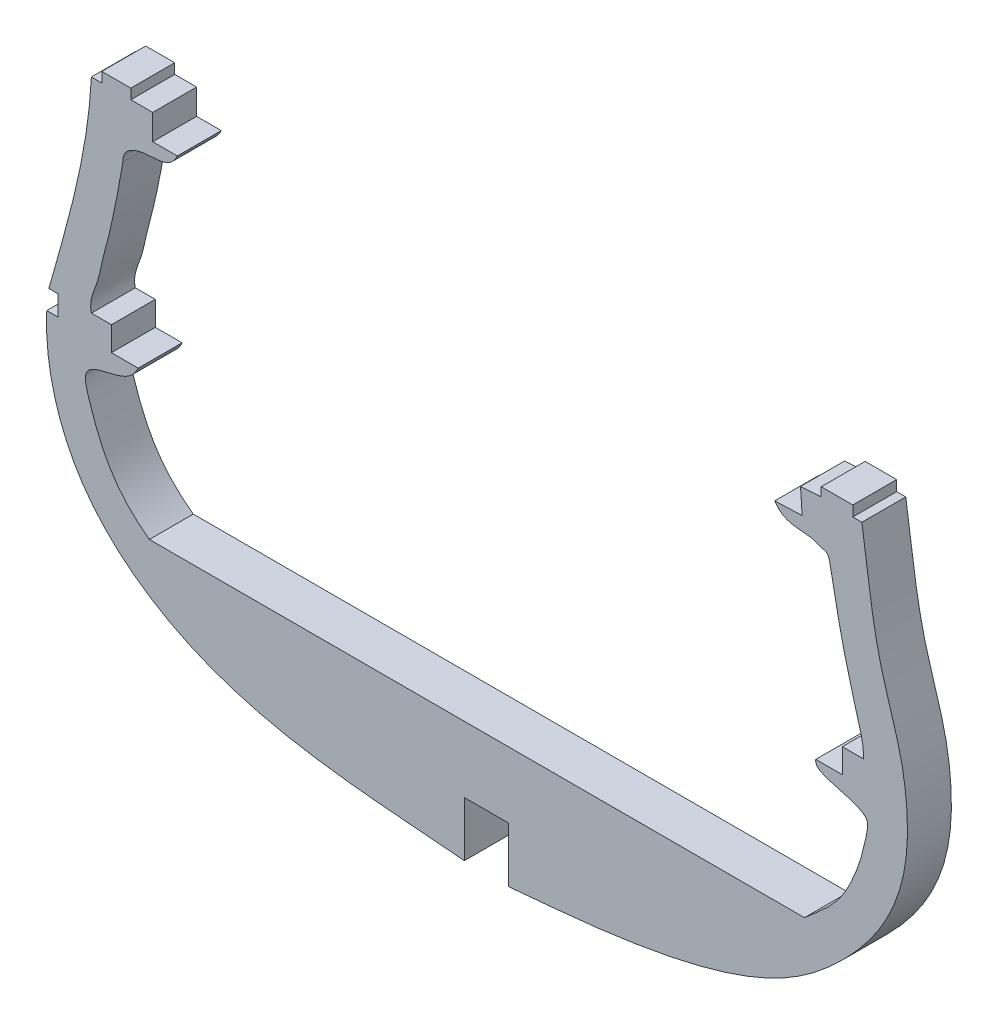
from build123d import *

# Parameters (mm, degrees)
EXTRUDE_1_DEPTH = 8


with BuildPart() as part:
    # 草图1 → 凸台-拉伸1 (new body)
    with BuildSketch(Plane.XY):
        with BuildLine():
            Line((1817.483715836, -493.825942956), (1936.795496106, -493.825942956))
            add(Edge.make_bspline(
                [(1936.795496106, -493.825942956), (1939.747205065, -491.176513643), (1944.2875945, -488.011108288), (1947.275764377, -479.018631105), (1947.507857706, -477.572527646)],
                knots=[0, 0, 0, 0, 0.565522661, 1, 1, 1, 1], degree=3))
            add(Edge.make_bspline(
                [(1938.85465802, -467.826292211), (1938.747248524, -468.790640628), (1940.08271868, -469.517965224), (1942.928801099, -470.453243252), (1945.705758528, -470.970230575), (1948.479929892, -472.559992486), (1948.144981641, -475.039552925), (1947.844617595, -476.44560544), (1947.507857706, -477.572527646)],
                knots=[0, 0, 0, 0, 0.139251813, 0.269940583, 0.567641647, 0.702119282, 0.788209765, 1, 1, 1, 1], degree=3))
            Line((1938.85465802, -467.826292211), (1943.682232582, -467.826292211))
            Line((1943.682232582, -467.826292211), (1943.682232582, -463.408606056))
            Line((1943.682232582, -463.408606056), (1947.507857706, -463.408606056))
            add(Edge.make_bspline(
                [(1947.507857706, -463.408606056), (1947.644081893, -461.495199541), (1946.520167415, -457.500364323), (1944.513422546, -450.590855735), (1942.814624339, -442.986643708), (1941.871430704, -437.596676652), (1941.126830231, -434.120937124), (1939.790888184, -433.95108547), (1938.780764124, -433.422181689), (1935.744837567, -432.821786941), (1933.008453776, -433.246758107), (1931.377193483, -430.790327181)],
                knots=[0, 0, 0, 0, 0.141971978, 0.305068463, 0.542473394, 0.707535874, 0.747502764, 0.772218948, 0.798960348, 0.833580938, 1, 1, 1, 1], degree=3))
            Line((1931.377193483, -430.790327181), (1936.37470245, -430.607172402))
            Line((1936.37470245, -430.607172402), (1936.081711435, -426.161193192))
            Line((1936.081711435, -426.161193192), (1939.854643249, -425.912556149))
            Line((1939.854643249, -425.912556149), (1939.854643249, -424.327579983))
            Line((1939.854643249, -424.327579983), (1945.595045144, -424.327579983))
            Line((1945.595045144, -424.327579983), (1945.595045144, -426.231632553))
            Line((1945.595045144, -426.231632553), (1947.245608576, -426.231632553))
            add(Edge.make_bspline(
                [(1947.245608576, -426.231632553), (1948.366615252, -433.204359796), (1949.374814619, -445.031727754), (1954.382912802, -458.218973948), (1956.779624263, -476.354127582), (1952.899985045, -489.099013973), (1936.4796815, -503.623940281), (1916.927875936, -513.806623528), (1890.695595323, -515.044667383), (1882.84950633, -515.88582089)],
                knots=[0, 0, 0, 0, 0.167478871, 0.276196699, 0.331934485, 0.591851171, 0.630173858, 0.715161347, 1, 1, 1, 1], degree=3))
            Line((1882.84950633, -515.88582089), (1882.84950633, -505.847461251))
            Line((1882.84950633, -505.847461251), (1874.850484606, -505.847461251))
            Line((1874.850484606, -505.847461251), (1874.850484606, -515.815381529))
            add(Edge.make_bspline(
                [(1798.793058799, -467.067195529), (1798.373910849, -475.483548392), (1802.571951061, -491.652561332), (1830.113890776, -513.737805099), (1857.262557517, -514.219471382), (1874.850484606, -515.815381529)],
                knots=[0, 0, 0, 0, 0.251171204, 0.460841663, 1, 1, 1, 1], degree=3))
            Line((1798.793058799, -467.067195529), (1800.819597975, -467.067195529))
            Line((1800.819597975, -467.067195529), (1800.819597975, -463.408606056))
            Line((1800.819597975, -463.408606056), (1799.177963162, -463.408606056))
            add(Edge.make_bspline(
                [(1799.177963162, -463.408606056), (1802.610090374, -451.202753829), (1806.315603165, -438.91991757), (1806.918680909, -426.161193192)],
                knots=[0, 0, 0, 0, 1, 1, 1, 1], degree=3))
            Line((1806.918680909, -426.161193192), (1808.814029121, -426.161193192))
            Line((1808.814029121, -426.161193192), (1808.814029121, -424.327579983))
            Line((1808.814029121, -424.327579983), (1814.101053078, -424.327579983))
            Line((1814.101053078, -424.327579983), (1814.101053078, -426.161193192))
            Line((1814.101053078, -426.161193192), (1818.091259838, -426.161193192))
            Line((1818.091259838, -426.161193192), (1818.091259838, -430.790327181))
            Line((1818.091259838, -430.790327181), (1822.580242443, -430.790327181))
            add(Edge.make_bspline(
                [(1812.661367598, -436.679246025), (1812.594104804, -434.671911838), (1816.816514674, -432.473909369), (1821.174335654, -433.791417411), (1822.580242443, -430.790327181)],
                knots=[0, 0, 0, 0, 0.40393493, 1, 1, 1, 1], degree=3))
            add(Edge.make_bspline(
                [(1806.918680909, -463.408606056), (1806.43605636, -461.391437349), (1808.030340289, -458.653747617), (1808.846583553, -454.190275227), (1810.793601017, -447.243989986), (1811.868086649, -441.214704861), (1812.661367598, -436.679246025)],
                knots=[0, 0, 0, 0, 0.211182266, 0.331084874, 0.496001788, 1, 1, 1, 1], degree=3))
            Line((1806.918680909, -463.408606056), (1810.568796148, -463.408606056))
            Line((1810.568796148, -463.408606056), (1810.568796148, -467.826292211))
            Line((1810.568796148, -467.826292211), (1815.447606527, -467.826292211))
            add(Edge.make_bspline(
                [(1817.483715836, -493.825942956), (1811.475963031, -489.464312999), (1808.27204524, -483.56463233), (1805.166709499, -472.766269003), (1810.654910833, -470.830344712), (1814.113936464, -470.706525868), (1815.447606527, -467.826292211)],
                knots=[0, 0, 0, 0, 0.575037688, 0.693620289, 0.776964582, 1, 1, 1, 1], degree=3))
        make_face()
    extrude(amount=EXTRUDE_1_DEPTH)


solid = part.part
